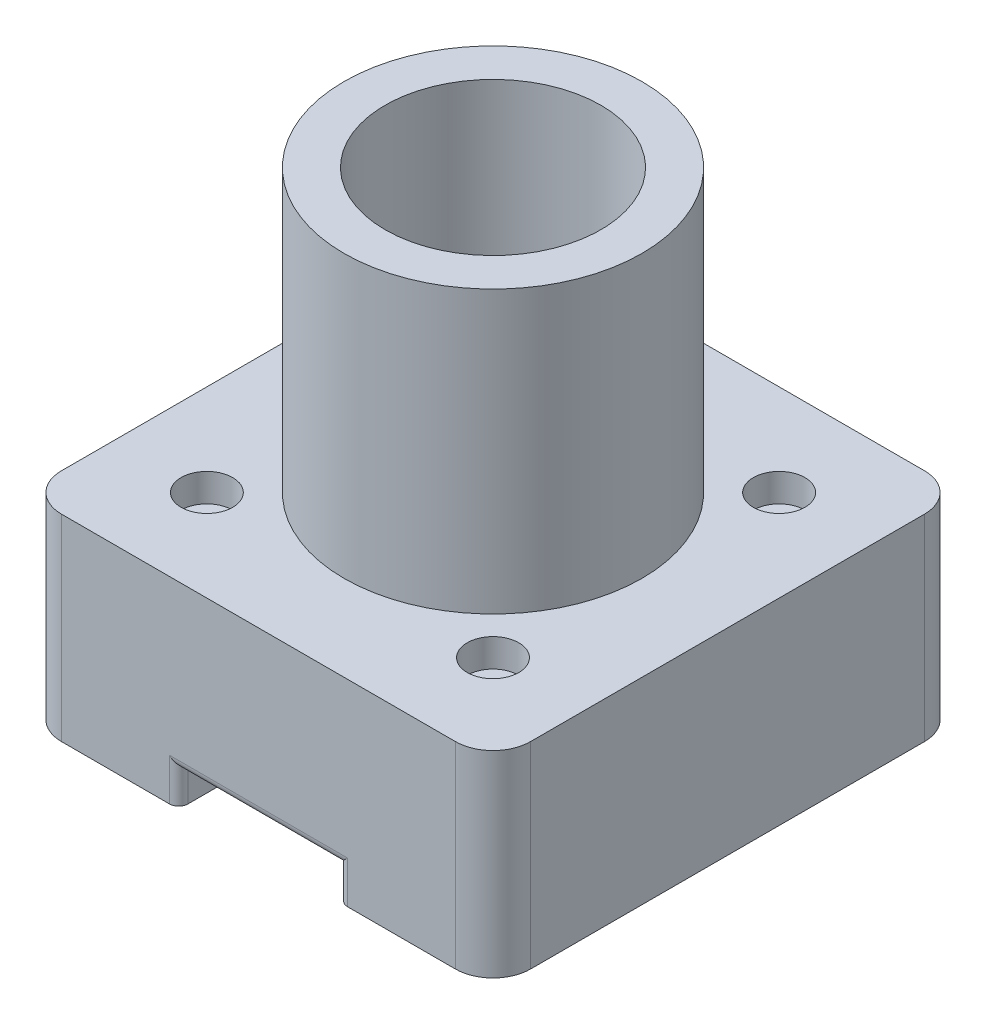
from build123d import *

# Parameters (mm, degrees)
BOSS_EXTRUDE1_DEPTH     = 16
SKETCH4_3_R             = 2.75
SKETCH4_3_R_2           = 1.5
BOSS_EXTRUDE2_DEPTH     = 11
SKETCH4_4_R             = 13.7
BOSS_EXTRUDE3_DEPTH     = 7
BOSS_EXTRUDE4_START     = 5
BOSS_EXTRUDE4_DEPTH     = 5
BOSS_EXTRUDE5_START     = 5
SKETCH4_6_R             = 15.875
BOSS_EXTRUDE5_DEPTH     = 30
CUT_EXTRUDE1_DEPTH      = 50.749371855
CUT_EXTRUDE1_DEPTH_BACK = 7
SKETCH4_7_R             = 11.5
CUT_EXTRUDE4_DEPTH      = 50.749371855
CUT_EXTRUDE4_DEPTH_BACK = 50.749371855
SKETCH4_8_R             = 1.5
CUT_EXTRUDE5_START      = 5
SKETCH4_9_R             = 2.75
CUT_EXTRUDE5_DEPTH      = 3
SKETCH4_10_W            = 17
SKETCH4_10_H            = 5.5
BOSS_EXTRUDE6_DEPTH     = 12.5
FILLET1_R               = 1


with BuildPart() as part:
    # Sketch4 → Boss-Extrude1 (new body)
    with BuildSketch(Plane(origin=(0, 0, 0), x_dir=(1, 0, 0), z_dir=(0, 1, 0))):
        with BuildLine():
            Line((8.5, -25), (21, -25))
            ThreePointArc((21, -25), (23.828427125, -23.828427125), (25, -21))
            Line((25, -21), (25, 21))
            ThreePointArc((25, 21), (23.828427125, 23.828427125), (21, 25))
            Line((21, 25), (-21, 25))
            ThreePointArc((-21, 25), (-23.828427125, 23.828427125), (-25, 21))
            Line((-25, 21), (-25, -21))
            ThreePointArc((-25, -21), (-23.828427125, -23.828427125), (-21, -25))
            Line((-21, -25), (-8.5, -25))
            Line((-8.5, -25), (-8.5, -19.5))
            Line((-8.5, -19.5), (-15.5, -19.5))
            ThreePointArc((-15.5, -19.5), (-18.328427125, -18.328427125), (-19.5, -15.5))
            Line((-19.5, -15.5), (-19.5, 15.5))
            ThreePointArc((-19.5, 15.5), (-18.328427125, 18.328427125), (-15.5, 19.5))
            Line((-15.5, 19.5), (-5.5, 19.5))
            Line((-5.5, 19.5), (-5.5, 22))
            Line((-5.5, 22), (5.5, 22))
            Line((5.5, 22), (5.5, 19.5))
            Line((5.5, 19.5), (15.5, 19.5))
            ThreePointArc((15.5, 19.5), (18.328427125, 18.328427125), (19.5, 15.5))
            Line((19.5, 15.5), (19.5, -15.5))
            ThreePointArc((19.5, -15.5), (18.328427125, -18.328427125), (15.5, -19.5))
            Line((15.5, -19.5), (8.5, -19.5))
            Line((8.5, -19.5), (8.5, -25))
        make_face()
    extrude(amount=-BOSS_EXTRUDE1_DEPTH)

    # Sketch4<3> → Boss-Extrude2 (add)
    # profile 1 of 7: a face of its own
    with BuildSketch(Plane(origin=(0, 0, 0), x_dir=(1, 0, 0), z_dir=(0, 1, 0))):
        with BuildLine():
            Line((-8.5, -19.5), (8.5, -19.5))
            Line((8.5, -19.5), (15.5, -19.5))
            ThreePointArc((15.5, -19.5), (18.328427125, -18.328427125), (19.5, -15.5))
            Line((19.5, -15.5), (19.5, 15.5))
            ThreePointArc((19.5, 15.5), (18.328427125, 18.328427125), (15.5, 19.5))
            Line((15.5, 19.5), (5.5, 19.5))
            Line((5.5, 19.5), (5.5, 17.139136501))
            ThreePointArc((5.5, 17.139136501), (14.543039572, 10.606601718), (18, 0))
            ThreePointArc((18, 0), (-10.606601718, -14.543039572), (-5.5, 17.139136501))
            Line((-5.5, 17.139136501), (-5.5, 19.5))
            Line((-5.5, 19.5), (-15.5, 19.5))
            ThreePointArc((-15.5, 19.5), (-18.328427125, 18.328427125), (-19.5, 15.5))
            Line((-19.5, 15.5), (-19.5, -15.5))
            ThreePointArc((-19.5, -15.5), (-18.328427125, -18.328427125), (-15.5, -19.5))
            Line((-15.5, -19.5), (-8.5, -19.5))
        make_face()
        with Locations((-15.25, -15.25)):
            Circle(SKETCH4_3_R, mode=Mode.SUBTRACT)
        with Locations((15.25, -15.25)):
            Circle(SKETCH4_3_R, mode=Mode.SUBTRACT)
        with Locations((-15.25, 15.25)):
            Circle(SKETCH4_3_R, mode=Mode.SUBTRACT)
        with Locations((15.25, 15.25)):
            Circle(SKETCH4_3_R, mode=Mode.SUBTRACT)
    # profile 2 of 7: a face of its own
    with BuildSketch(Plane(origin=(0, 0, 0), x_dir=(1, 0, 0), z_dir=(0, 1, 0))):
        with BuildLine():
            Line((-8.5, -19.5), (8.5, -19.5))
            Line((8.5, -19.5), (15.5, -19.5))
            ThreePointArc((15.5, -19.5), (18.328427125, -18.328427125), (19.5, -15.5))
            Line((19.5, -15.5), (19.5, 15.5))
            ThreePointArc((19.5, 15.5), (18.328427125, 18.328427125), (15.5, 19.5))
            Line((15.5, 19.5), (5.5, 19.5))
            Line((5.5, 19.5), (5.5, 17.139136501))
            ThreePointArc((5.5, 17.139136501), (14.543039572, 10.606601718), (18, 0))
            ThreePointArc((18, 0), (-10.606601718, -14.543039572), (-5.5, 17.139136501))
            Line((-5.5, 17.139136501), (-5.5, 19.5))
            Line((-5.5, 19.5), (-15.5, 19.5))
            ThreePointArc((-15.5, 19.5), (-18.328427125, 18.328427125), (-19.5, 15.5))
            Line((-19.5, 15.5), (-19.5, -15.5))
            ThreePointArc((-19.5, -15.5), (-18.328427125, -18.328427125), (-15.5, -19.5))
            Line((-15.5, -19.5), (-8.5, -19.5))
        make_face()
        with Locations((-15.25, -15.25)):
            Circle(SKETCH4_3_R, mode=Mode.SUBTRACT)
        with Locations((15.25, -15.25)):
            Circle(SKETCH4_3_R, mode=Mode.SUBTRACT)
        with Locations((-15.25, 15.25)):
            Circle(SKETCH4_3_R, mode=Mode.SUBTRACT)
        with Locations((15.25, 15.25)):
            Circle(SKETCH4_3_R, mode=Mode.SUBTRACT)
    # profile 3 of 7: a face of its own
    with BuildSketch(Plane(origin=(0, 0, 0), x_dir=(1, 0, 0), z_dir=(0, 1, 0))):
        with BuildLine():
            Line((-8.5, -19.5), (8.5, -19.5))
            Line((8.5, -19.5), (15.5, -19.5))
            ThreePointArc((15.5, -19.5), (18.328427125, -18.328427125), (19.5, -15.5))
            Line((19.5, -15.5), (19.5, 15.5))
            ThreePointArc((19.5, 15.5), (18.328427125, 18.328427125), (15.5, 19.5))
            Line((15.5, 19.5), (5.5, 19.5))
            Line((5.5, 19.5), (5.5, 17.139136501))
            ThreePointArc((5.5, 17.139136501), (14.543039572, 10.606601718), (18, 0))
            ThreePointArc((18, 0), (-10.606601718, -14.543039572), (-5.5, 17.139136501))
            Line((-5.5, 17.139136501), (-5.5, 19.5))
            Line((-5.5, 19.5), (-15.5, 19.5))
            ThreePointArc((-15.5, 19.5), (-18.328427125, 18.328427125), (-19.5, 15.5))
            Line((-19.5, 15.5), (-19.5, -15.5))
            ThreePointArc((-19.5, -15.5), (-18.328427125, -18.328427125), (-15.5, -19.5))
            Line((-15.5, -19.5), (-8.5, -19.5))
        make_face()
        with Locations((-15.25, -15.25)):
            Circle(SKETCH4_3_R, mode=Mode.SUBTRACT)
        with Locations((15.25, -15.25)):
            Circle(SKETCH4_3_R, mode=Mode.SUBTRACT)
        with Locations((-15.25, 15.25)):
            Circle(SKETCH4_3_R, mode=Mode.SUBTRACT)
        with Locations((15.25, 15.25)):
            Circle(SKETCH4_3_R, mode=Mode.SUBTRACT)
    # profile 4 of 7: a face of its own
    with BuildSketch(Plane(origin=(0, 0, 0), x_dir=(1, 0, 0), z_dir=(0, 1, 0))):
        with Locations((-15.25, -15.25)):
            Circle(SKETCH4_3_R)
        with Locations(Location((-15.25, -15.25, 0), (0, 0, 270))):
            Circle(SKETCH4_3_R_2, mode=Mode.SUBTRACT)
    # profile 5 of 7: a face of its own
    with BuildSketch(Plane(origin=(0, 0, 0), x_dir=(1, 0, 0), z_dir=(0, 1, 0))):
        with Locations((15.25, -15.25)):
            Circle(SKETCH4_3_R)
        with Locations(Location((15.25, -15.25, 0), (0, 0, 270))):
            Circle(SKETCH4_3_R_2, mode=Mode.SUBTRACT)
    # profile 6 of 7: a face of its own
    with BuildSketch(Plane(origin=(0, 0, 0), x_dir=(1, 0, 0), z_dir=(0, 1, 0))):
        with Locations((15.25, 15.25)):
            Circle(SKETCH4_3_R)
        with Locations(Location((15.25, 15.25, 0), (0, 0, 270))):
            Circle(SKETCH4_3_R_2, mode=Mode.SUBTRACT)
    # profile 7 of 7: a face of its own
    with BuildSketch(Plane(origin=(0, 0, 0), x_dir=(1, 0, 0), z_dir=(0, 1, 0))):
        with Locations((-15.25, 15.25)):
            Circle(SKETCH4_3_R)
        with Locations(Location((-15.25, 15.25, 0), (0, 0, 270))):
            Circle(SKETCH4_3_R_2, mode=Mode.SUBTRACT)
    extrude(amount=-BOSS_EXTRUDE2_DEPTH)



with BuildPart() as body_2:
    # Sketch4<4> → Boss-Extrude3 (new body)
    with BuildSketch(Plane(origin=(0, 0, 0), x_dir=(1, 0, 0), z_dir=(0, 1, 0))):
        with Locations(Location((0, 0, 0), (0, 0, 270))):
            Circle(SKETCH4_4_R)
    extrude(amount=-BOSS_EXTRUDE3_DEPTH)

    # Sketch4<5> → Boss-Extrude4 (add)
    with BuildSketch(Plane(origin=(0, 0, 0), x_dir=(1, 0, 0), z_dir=(0, 1, 0)).offset(BOSS_EXTRUDE4_START)):
        with BuildLine():
            Line((21, -25), (-21, -25))
            ThreePointArc((-21, -25), (-23.828427125, -23.828427125), (-25, -21))
            Line((-25, -21), (-25, 21))
            ThreePointArc((-25, 21), (-23.828427125, 23.828427125), (-21, 25))
            Line((-21, 25), (21, 25))
            ThreePointArc((21, 25), (23.828427125, 23.828427125), (25, 21))
            Line((25, 21), (25, -21))
            ThreePointArc((25, -21), (23.828427125, -23.828427125), (21, -25))
        make_face()
    extrude(amount=-BOSS_EXTRUDE4_DEPTH)

    # Sketch4<6> → Boss-Extrude5 (add)
    with BuildSketch(Plane(origin=(0, 0, 0), x_dir=(1, 0, 0), z_dir=(0, 1, 0)).offset(BOSS_EXTRUDE5_START)):
        with Locations(Location((0, 0, 0), (0, 0, 270))):
            Circle(SKETCH4_6_R)
    extrude(amount=BOSS_EXTRUDE5_DEPTH)

    # Sketch4<7> → Cut-Extrude1 (cut, two sides: drawn at the far end of the back side and taken through both)
    with BuildSketch(Plane(origin=(0, 0, 0), x_dir=(1, 0, 0), z_dir=(0, 1, 0)).offset(-CUT_EXTRUDE1_DEPTH_BACK)):
        with Locations(Location((0, 0, 0), (0, 0, 270))):
            Circle(SKETCH4_7_R)
    extrude(amount=CUT_EXTRUDE1_DEPTH + CUT_EXTRUDE1_DEPTH_BACK, mode=Mode.SUBTRACT)

    # Sketch4<8> → Cut-Extrude4 (cut, two sides: drawn at the far end of the back side and taken through both)
    with BuildSketch(Plane(origin=(0, 0, 0), x_dir=(1, 0, 0), z_dir=(0, 1, 0)).offset(-CUT_EXTRUDE4_DEPTH_BACK)):
        with Locations(Location((15.25, -15.25, 0), (0, 0, 270))):
            Circle(SKETCH4_8_R)
        with Locations(Location((-15.25, -15.25, 0), (0, 0, 270))):
            Circle(SKETCH4_8_R)
        with Locations(Location((-15.25, 15.25, 0), (0, 0, 270))):
            Circle(SKETCH4_8_R)
        with Locations(Location((15.25, 15.25, 0), (0, 0, 270))):
            Circle(SKETCH4_8_R)
    extrude(amount=CUT_EXTRUDE4_DEPTH + CUT_EXTRUDE4_DEPTH_BACK, mode=Mode.SUBTRACT)

    # Sketch4<9> → Cut-Extrude5 (cut)
    with BuildSketch(Plane(origin=(0, 0, 0), x_dir=(1, 0, 0), z_dir=(0, 1, 0)).offset(CUT_EXTRUDE5_START)):
        with Locations(Location((-15.25, -15.25, 0), (0, 0, 270))):
            Circle(SKETCH4_9_R)
        with Locations(Location((15.25, -15.25, 0), (0, 0, 270))):
            Circle(SKETCH4_9_R)
        with Locations(Location((15.25, 15.25, 0), (0, 0, 270))):
            Circle(SKETCH4_9_R)
        with Locations(Location((-15.25, 15.25, 0), (0, 0, 270))):
            Circle(SKETCH4_9_R)
    extrude(amount=-CUT_EXTRUDE5_DEPTH, mode=Mode.SUBTRACT)


with BuildPart() as part_1:
    add(part.part)

    add(body_2.part)  # Boss-Extrude6 merges body 2
    # Sketch4<10> → Boss-Extrude6 (add)
    with BuildSketch(Plane(origin=(0, 0, 0), x_dir=(1, 0, 0), z_dir=(0, 1, 0))):
        with Locations((0, -22.25)):
            Rectangle(SKETCH4_10_W, SKETCH4_10_H)
    extrude(amount=-BOSS_EXTRUDE6_DEPTH)

    # Fillet1
    fillet1_edges = [part_1.edges().sort_by_distance(p)[0] for p in [
        (0, -12.5, 19.5),
        (0, -12.5, 25),
        (-8.5, -14.25, 19.5),
        (-8.5, -14.25, 25),
        (8.5, -14.25, 25),
        (8.5, -14.25, 19.5),
    ]]
    fillet(fillet1_edges, radius=FILLET1_R)


solid = part_1.part
